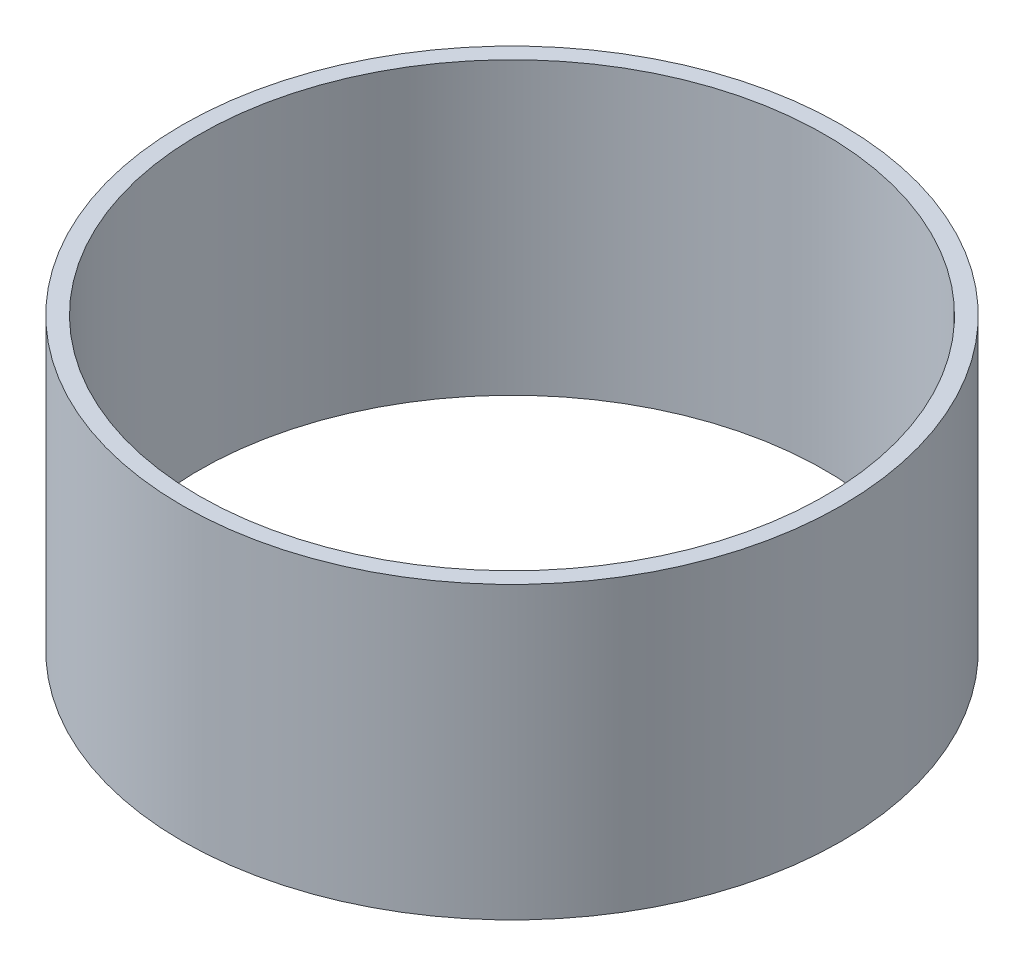
from build123d import *

# Parameters (mm, degrees)
SKETCH1_R           = 93.6625
SKETCH1_R_2         = 88.9
BOSS_EXTRUDE1_DEPTH = 41.275


with BuildPart() as part:
    # Sketch1 → Boss-Extrude1 (new, symmetric)
    with BuildSketch(Plane(origin=(0, 0, 0), x_dir=(1, 0, 0), z_dir=(0, 1, 0))):
        with Locations(Location((0, 0, 0), (0, 0, 270))):
            Circle(SKETCH1_R)
        with Locations(Location((0, 0, 0), (0, 0, 270))):
            Circle(SKETCH1_R_2, mode=Mode.SUBTRACT)
    extrude(amount=BOSS_EXTRUDE1_DEPTH, both=True)


solid = part.part
